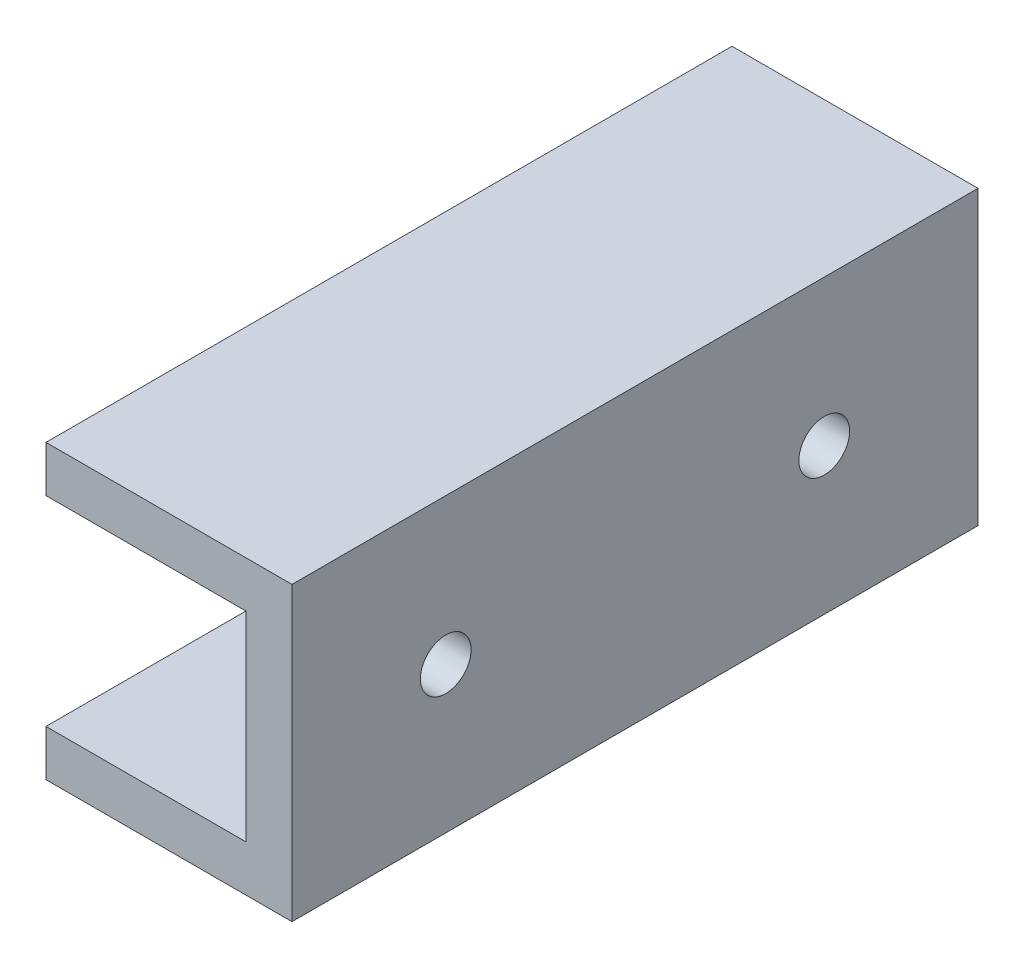
from build123d import *

# Parameters (mm, degrees)
SKETCH_1_W          = 19
SKETCH_1_H          = 19
SKETCH_1_W_2        = 13
SKETCH_1_H_2        = 13
EXTRUDE_1_DEPTH     = 44.62
SKETCH_2_R          = 1.65
CUT_EXTRUDE_1_DEPTH = 30
SKETCH_3_W          = 314.053168424
SKETCH_3_H          = 46.219516436
CUT_EXTRUDE_2_DEPTH = 3


with BuildPart() as part:
    # 草图1 → Extrude 1 (new body)
    with BuildSketch(Plane.XY):
        with Locations((6.5, 6.5)):
            Rectangle(SKETCH_1_W, SKETCH_1_H)
        with Locations((6.5, 6.5)):
            Rectangle(SKETCH_1_W_2, SKETCH_1_H_2, mode=Mode.SUBTRACT)
    extrude(amount=EXTRUDE_1_DEPTH)

    # 草图2 → 切除-拉伸1 (cut)
    with BuildSketch(Plane.ZY.offset(3)):
        with Locations((10, 6.5)):
            Circle(SKETCH_2_R)
        with Locations((34.62, 6.5)):
            Circle(SKETCH_2_R)
    extrude(amount=-CUT_EXTRUDE_1_DEPTH, mode=Mode.SUBTRACT)

    # 草图3 → 切除-拉伸2 (cut)
    with BuildSketch(Plane.ZY.offset(3)):
        with Locations((151.731232528, 0.202739406)):
            Rectangle(SKETCH_3_W, SKETCH_3_H)
    extrude(amount=-CUT_EXTRUDE_2_DEPTH, mode=Mode.SUBTRACT)


solid = part.part
